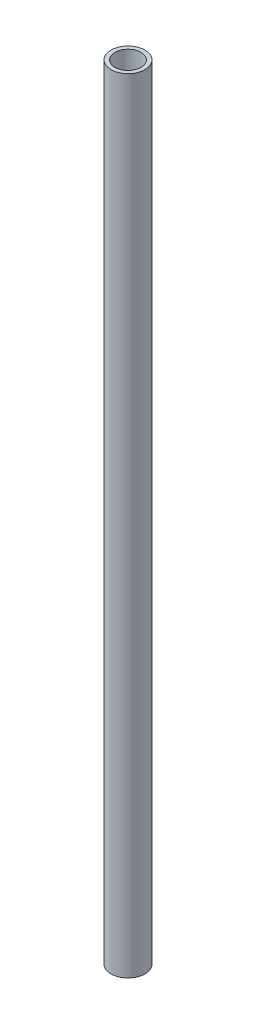
from build123d import *

# Parameters (mm, degrees)
SKETCH1_R           = 6.5
SKETCH1_R_2         = 3.5
BOSS_EXTRUDE1_DEPTH = 300
SKETCH2_R           = 5
CUT_EXTRUDE1_DEPTH  = 31
CUT_EXTRUDE2_START  = -269
SKETCH2_2_R         = 5
CUT_EXTRUDE2_DEPTH  = 31


with BuildPart() as part:
    # Sketch1 → Boss-Extrude1 (new body)
    with BuildSketch(Plane(origin=(0, 0, 0), x_dir=(1, 0, 0), z_dir=(0, 1, 0))):
        with Locations(Location((0, 0, 0), (0, 0, 270))):
            Circle(SKETCH1_R)
        with Locations(Location((0, 0, 0), (0, 0, 270))):
            Circle(SKETCH1_R_2, mode=Mode.SUBTRACT)
    extrude(amount=BOSS_EXTRUDE1_DEPTH)

    # Sketch2 → Cut-Extrude1 (cut)
    with BuildSketch(Plane(origin=(0, 300, 0), x_dir=(1, 0, 0), z_dir=(0, 1, 0))):
        with Locations(Location((0, 0, 0), (0, 0, 270))):
            Circle(SKETCH2_R)
    extrude(amount=-CUT_EXTRUDE1_DEPTH, mode=Mode.SUBTRACT)

    # Sketch2<2> → Cut-Extrude2 (cut)
    with BuildSketch(Plane(origin=(0, 300, 0), x_dir=(1, 0, 0), z_dir=(0, 1, 0)).offset(CUT_EXTRUDE2_START)):
        with Locations(Location((0, 0, 0), (0, 0, 270))):
            Circle(SKETCH2_2_R)
    extrude(amount=-CUT_EXTRUDE2_DEPTH, mode=Mode.SUBTRACT)


solid = part.part
